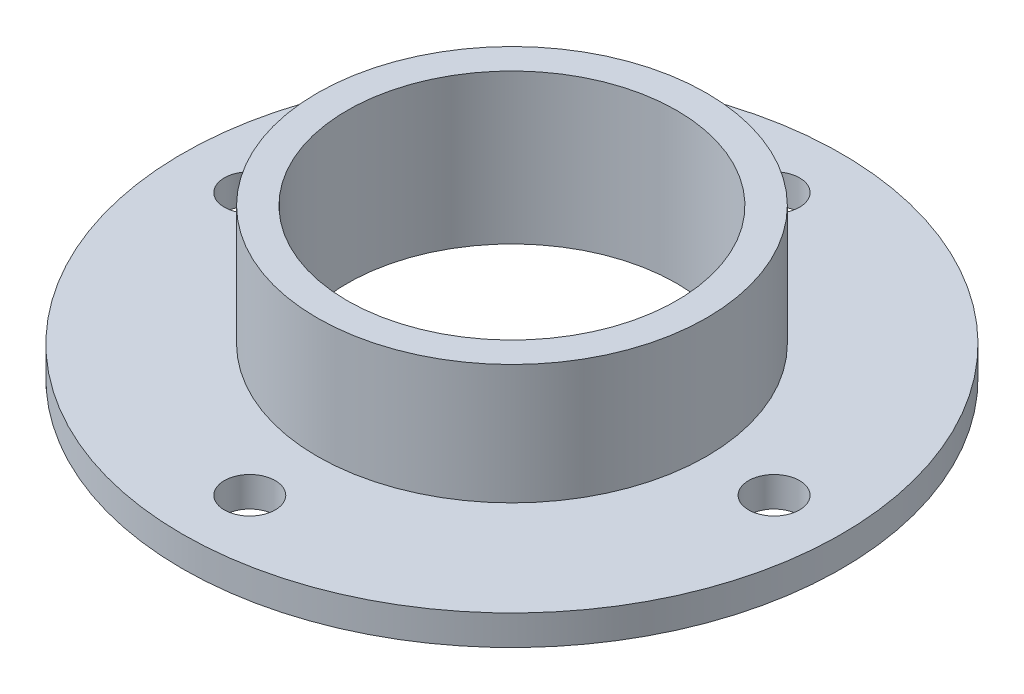
from build123d import *

# Parameters (mm, degrees)
SKETCH2_R            = 11
CUT_EXTRUDE1_DEPTH   = 33.124756808
M3_CLEARANCE_HOLE1_D = 3.4


with BuildPart() as part:
    # Sketch1 → Revolve1 (revolve)
    with BuildSketch(Plane.XY, mode=Mode.PRIVATE) as revolve1_sk:
        Polygon((9, 0), (11, 0), (11, 8), (13, 8), (13, 0), (22, 0), (22, -2), (9, -2), align=None)
    revolve(revolve1_sk.sketch.rotate(Axis((0, 17.954019247, 0), (0, -1, 0)), 90), axis=Axis((0, 17.954019247, 0), (0, -1, 0)))

    # Sketch2 → Cut-Extrude1 (cut, through all)
    with BuildSketch(Plane(origin=(0, 0, 0), x_dir=(1, 0, 0), z_dir=(0, 1, 0))):
        with Locations(Location((0, 0, 0), (0, 0, 270))):
            Circle(SKETCH2_R)
    extrude(amount=-CUT_EXTRUDE1_DEPTH, mode=Mode.SUBTRACT)

    # M3 Clearance Hole1 (through all)
    with Locations(Plane(origin=(0, 0, 0), x_dir=(1, 0, 0), z_dir=(0, 1, 0))):
        with Locations((0, 17.5), (17.5, 0), (0, -17.5), (-17.5, 0)):
            Hole(M3_CLEARANCE_HOLE1_D / 2)


solid = part.part
